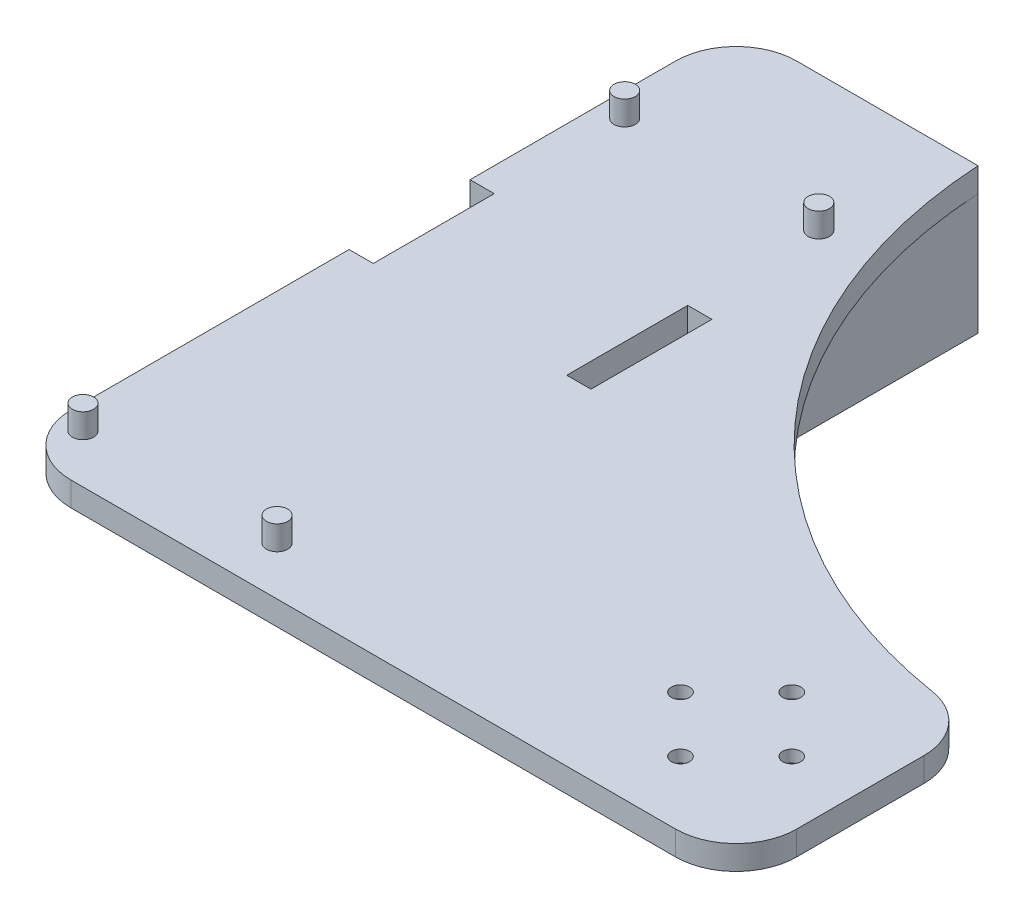
from build123d import *

# Parameters (mm, degrees)
SKETCH1_R           = 0.9525
BOSS_EXTRUDE1_DEPTH = 2.54
SKETCH2_W           = 2.54
SKETCH2_H           = 25.4
BOSS_EXTRUDE2_DEPTH = 12.7
FILLET2_R           = 6.35
FILLET3_R           = 6.35
FILLET4_R           = 6.35
FILLET5_R           = 6.35
SKETCH3_R           = 1.905
CUT_EXTRUDE1_DEPTH  = 1.27
SKETCH4_W           = 2.54
SKETCH4_H           = 12.7
CUT_EXTRUDE2_DEPTH  = 109.508847566
SKETCH5_R           = 1.1176
BOSS_EXTRUDE3_DEPTH = 2.54


with BuildPart() as part:
    # Sketch1 → Boss-Extrude1 (new body)
    with BuildSketch(Plane(origin=(0, 0, 0), x_dir=(1, 0, 0), z_dir=(0, 1, 0))):
        with BuildLine():
            Line((0, 0), (0, 76.2))
            Line((0, 76.2), (25.4, 76.2))
            ThreePointArc((25.4, 76.2), (41.142937212, 41.142937212), (76.2, 25.4))
            Line((76.2, 25.4), (76.2, 0))
            Line((76.2, 0), (0, 0))
        make_face()
        with Locations(Location((63.5, 6.858, 0), (0, 0, 270))):
            Circle(SKETCH1_R, mode=Mode.SUBTRACT)
        with Locations(Location((57.658, 12.7, 0), (0, 0, 270))):
            Circle(SKETCH1_R, mode=Mode.SUBTRACT)
        with Locations(Location((63.5, 18.542, 0), (0, 0, 270))):
            Circle(SKETCH1_R, mode=Mode.SUBTRACT)
        with Locations(Location((69.342, 12.7, 0), (0, 0, 270))):
            Circle(SKETCH1_R, mode=Mode.SUBTRACT)
    extrude(amount=BOSS_EXTRUDE1_DEPTH)

    # Sketch2 → Boss-Extrude2 (add)
    with BuildSketch(Plane.XZ):
        with Locations((1.27, -63.5)):
            Rectangle(SKETCH2_W, SKETCH2_H)
        with Locations((24.13, -63.5)):
            Rectangle(SKETCH2_W, SKETCH2_H)
    extrude(amount=BOSS_EXTRUDE2_DEPTH)

    # Fillet2
    fillet2_edges = [part.edges().sort_by_distance(p)[0] for p in [
        (0, -5.08, -76.2),
    ]]
    fillet(fillet2_edges, radius=FILLET2_R)

    # Fillet3
    fillet3_edges = [part.edges().sort_by_distance(p)[0] for p in [
        (0, 1.27, 0),
    ]]
    fillet(fillet3_edges, radius=FILLET3_R)

    # Fillet4
    fillet4_edges = [part.edges().sort_by_distance(p)[0] for p in [
        (76.2, 1.27, 0),
    ]]
    fillet(fillet4_edges, radius=FILLET4_R)

    # Fillet5
    fillet5_edges = [part.edges().sort_by_distance(p)[0] for p in [
        (76.2, 1.27, -25.4),
    ]]
    fillet(fillet5_edges, radius=FILLET5_R)

    # Sketch3 → Cut-Extrude1 (cut)
    with BuildSketch(Plane.XZ):
        with Locations(Location((63.5, -6.858, 0), (0, 0, 270))):
            Circle(SKETCH3_R)
        with Locations(Location((69.342, -12.7, 0), (0, 0, 270))):
            Circle(SKETCH3_R)
        with Locations(Location((57.658, -12.7, 0), (0, 0, 270))):
            Circle(SKETCH3_R)
        with Locations(Location((63.5, -18.542, 0), (0, 0, 270))):
            Circle(SKETCH3_R)
    extrude(amount=-CUT_EXTRUDE1_DEPTH, mode=Mode.SUBTRACT)

    # Sketch4 → Cut-Extrude2 (cut, through all)
    with BuildSketch(Plane.XZ):
        with Locations((24.13, -41.91)):
            Rectangle(SKETCH4_W, SKETCH4_H)
        with Locations((1.27, -41.91)):
            Rectangle(SKETCH4_W, SKETCH4_H)
    extrude(amount=-CUT_EXTRUDE2_DEPTH, mode=Mode.SUBTRACT)

    # Sketch5 → Boss-Extrude3 (add)
    with BuildSketch(Plane(origin=(0, 2.54, 0), x_dir=(1, 0, 0), z_dir=(0, 1, 0))):
        with Locations(Location((2.54, 5.08, 0), (0, 0, 270))):
            Circle(SKETCH5_R)
        with Locations(Location((2.54, 61.96076, 0), (0, 0, 270))):
            Circle(SKETCH5_R)
        with Locations(Location((22.92096, 61.96076, 0), (0, 0, 270))):
            Circle(SKETCH5_R)
        with Locations(Location((22.92096, 5.08, 0), (0, 0, 270))):
            Circle(SKETCH5_R)
    extrude(amount=BOSS_EXTRUDE3_DEPTH)


solid = part.part
